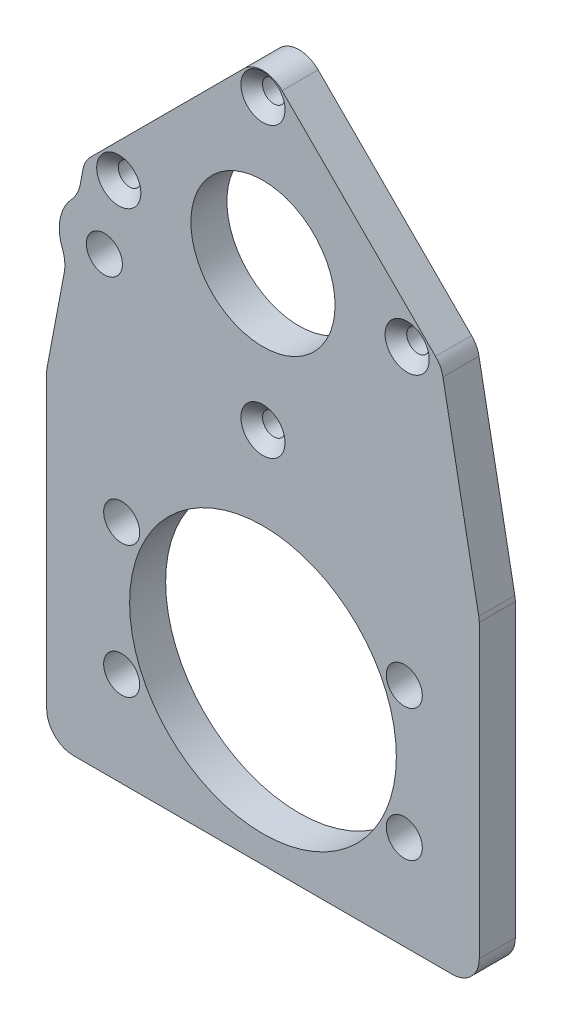
from build123d import *

# Parameters (mm, degrees)
SKETCH1_R           = 23.495
SKETCH1_R_2         = 3.175
SKETCH1_R_3         = 12.7
SKETCH1_R_4         = 1.984375
BOSS_EXTRUDE1_DEPTH = 6.35
FILLET1_R           = 4.7625
SKETCH2_R           = 3.175
CUT_EXTRUDE1_DEPTH  = 6.35
SKETCH2_3_R         = 3.175
BOSS_EXTRUDE2_DEPTH = 6.35
FILLET2_R           = 6.35
CHAMFER1_SIZE       = 1.905


with BuildPart() as part:
    # Sketch1 → Boss-Extrude1 (new body)
    with BuildSketch(Plane.XY.offset(171.45)):
        Polygon((38.1, 791.013640976), (31.430896424, 826.256140976), (0, 857.6870374), (-31.430896424, 826.256140976), (-38.1, 791.013640976), (-38.1, 734.498640976), (38.1, 734.498640976), align=None)
        with Locations((0, 762.756140976)):
            Circle(SKETCH1_R, mode=Mode.SUBTRACT)
        with Locations((-24.890610486, 774.362823262)):
            Circle(SKETCH1_R_2, mode=Mode.SUBTRACT)
        with Locations((24.890610486, 774.362823262)):
            Circle(SKETCH1_R_2, mode=Mode.SUBTRACT)
        with Locations((0, 826.256140976)):
            Circle(SKETCH1_R_3, mode=Mode.SUBTRACT)
        with Locations((-25.4, 826.256140976)):
            Circle(SKETCH1_R_4, mode=Mode.SUBTRACT)
        with Locations((0, 851.656140976)):
            Circle(SKETCH1_R_4, mode=Mode.SUBTRACT)
        with Locations((25.4, 826.256140976)):
            Circle(SKETCH1_R_4, mode=Mode.SUBTRACT)
        with Locations((0, 800.856140976)):
            Circle(SKETCH1_R_4, mode=Mode.SUBTRACT)
        with Locations((24.890610486, 751.14945869)):
            Circle(SKETCH1_R_2, mode=Mode.SUBTRACT)
        with Locations((-24.890610486, 751.14945869)):
            Circle(SKETCH1_R_2, mode=Mode.SUBTRACT)
    extrude(amount=BOSS_EXTRUDE1_DEPTH)

    # Fillet1
    fillet1_edges = [part.edges().sort_by_distance(p)[0] for p in [
        (0, 857.6870374, 174.625),
        (31.430896424, 826.256140976, 174.625),
        (38.1, 791.013640976, 174.625),
        (38.1, 734.498640976, 174.625),
        (-38.1, 734.498640976, 174.625),
        (-38.1, 791.013640976, 174.625),
        (-31.430896424, 826.256140976, 174.625),
    ]]
    fillet(fillet1_edges, radius=FILLET1_R)

    # Sketch2 → Cut-Extrude1 (cut)
    with BuildSketch(Plane.XY.offset(177.8)):
        with Locations((-27.94, 813.744260544)):
            Circle(SKETCH2_R)
    extrude(amount=-CUT_EXTRUDE1_DEPTH, mode=Mode.SUBTRACT)

    # Sketch2<3> → Boss-Extrude2 (add)
    # profile 1 of 2: a face of its own
    with BuildSketch(Plane.XY.offset(177.8)):
        with BuildLine():
            ThreePointArc((-34.612193634, 809.444756111), (-25.699088435, 806.129654736), (-20.0025, 813.744260544))
            ThreePointArc((-20.0025, 813.744260544), (-24.322344832, 820.809419943), (-32.579880116, 820.18440175))
            Line((-32.579880116, 820.18440175), (-34.612193634, 809.444756111))
        make_face()
        with Locations((-27.94, 813.744260544)):
            Circle(SKETCH2_3_R, mode=Mode.SUBTRACT)
    # profile 2 of 2: a face of its own
    with BuildSketch(Plane.XY.offset(177.8)):
        with BuildLine():
            Line((-34.612193634, 809.444756111), (-32.579880116, 820.18440175))
            ThreePointArc((-32.579880116, 820.18440175), (-35.739086501, 815.220118263), (-34.612193634, 809.444756111))
        make_face()
    extrude(amount=-BOSS_EXTRUDE2_DEPTH)

    # Fillet2
    fillet2_edges = [part.edges().sort_by_distance(p)[0] for p in [
        (-32.579880116, 820.18440175, 174.625),
        (-34.612193634, 809.444756111, 174.625),
    ]]
    fillet(fillet2_edges, radius=FILLET2_R)

    # Chamfer1
    chamfer1_edges = [part.edges().sort_by_distance(p)[0] for p in [
        (-27.384375, 826.256140976, 177.8),
        (-1.984375, 851.656140976, 177.8),
        (23.415625, 826.256140976, 177.8),
        (-1.984375, 800.856140976, 177.8),
    ]]
    chamfer(chamfer1_edges, length=CHAMFER1_SIZE)


solid = part.part
